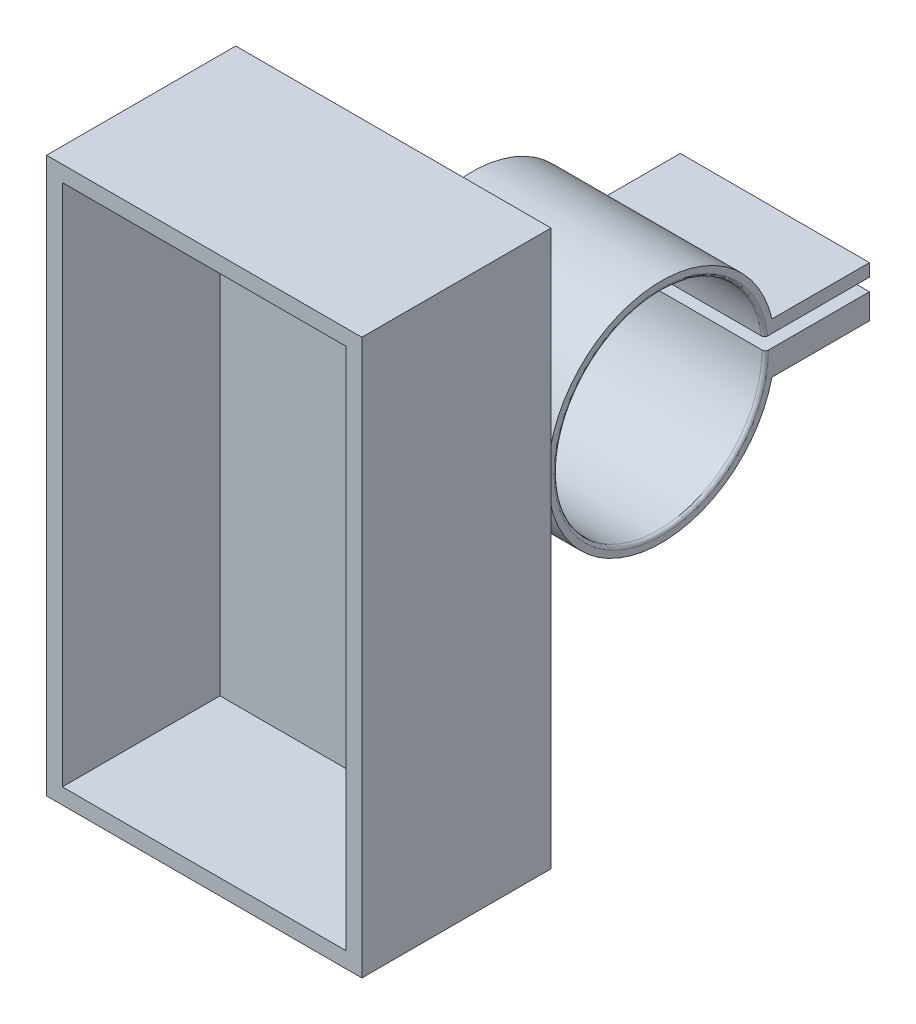
from build123d import *

# Parameters (mm, degrees)
ESBO_O1_W                     = 50
ESBO_O1_H                     = 88
RESSALTO_EXTRUS_O1_DEPTH      = 30
ESBO_O3_W                     = 45
ESBO_O3_H                     = 83
CORTE_EXTRUS_O1_DEPTH         = 25
ESBO_O7_R                     = 10.25
RESSALTO_EXTRUS_O3_DEPTH      = 15
FILETE1_R                     = 4
RESSALTO_EXTRUS_O4_DEPTH      = 15
RESSALTO_EXTRUS_O4_DEPTH_BACK = 15
ESBO_O9_R                     = 18
ESBO_O10_R                    = 16.5
CORTE_EXTRUS_O2_DEPTH         = 40
RESSALTO_EXTRUS_O5_DEPTH      = 15
RESSALTO_EXTRUS_O5_DEPTH_BACK = 15
ESBO_O12_W                    = 17
ESBO_O12_H                    = 2
CORTE_EXTRUS_O3_DEPTH         = 40
FILETE2_R                     = 0.5
FILETE3_R                     = 0.5


with BuildPart() as part:
    # Esboço1 → Ressalto-extrusão1 (new body)
    with BuildSketch(Plane.XY):
        Rectangle(ESBO_O1_W, ESBO_O1_H)
    extrude(amount=RESSALTO_EXTRUS_O1_DEPTH)

    # Esboço3 → Corte-extrusão1 (cut)
    with BuildSketch(Plane.XY.offset(30)):
        Rectangle(ESBO_O3_W, ESBO_O3_H)
    extrude(amount=-CORTE_EXTRUS_O1_DEPTH, mode=Mode.SUBTRACT)

    # Esboço7 → Ressalto-extrusão3 (add)
    with BuildSketch(Plane(origin=(0, 0, 0), x_dir=(-1, 0, 0), z_dir=(0, 0, -1))):
        Circle(ESBO_O7_R)
    extrude(amount=RESSALTO_EXTRUS_O3_DEPTH)

    # Filete1
    filete1_edges = [part.edges().sort_by_distance(p)[0] for p in [
        (10.25, 0, 0),
    ]]
    fillet(filete1_edges, radius=FILETE1_R)

    # Esboço9 → Ressalto-extrusão4 (add, two sides: drawn at the far end of the back side and taken through both)
    with BuildSketch(Plane(origin=(0, 0, 0), x_dir=(0, 0, -1), z_dir=(1, 0, 0)).offset(-RESSALTO_EXTRUS_O4_DEPTH_BACK)):
        with Locations((27.479364999, 0)):
            Circle(ESBO_O9_R)
    extrude(amount=RESSALTO_EXTRUS_O4_DEPTH + RESSALTO_EXTRUS_O4_DEPTH_BACK)

    # Esboço10 → Corte-extrusão2 (cut)
    with BuildSketch(Plane(origin=(15, 0, 0), x_dir=(0, 0, -1), z_dir=(1, 0, 0))):
        with Locations((27.479364999, 0)):
            Circle(ESBO_O10_R)
    extrude(amount=-CORTE_EXTRUS_O2_DEPTH, mode=Mode.SUBTRACT)

    # Esboço11 → Ressalto-extrusão5 (add, two sides: drawn at the far end of the back side and taken through both)
    with BuildSketch(Plane(origin=(0, 0, 0), x_dir=(0, 0, -1), z_dir=(1, 0, 0)).offset(-RESSALTO_EXTRUS_O5_DEPTH_BACK)):
        Polygon((60.492568737, 0), (60.492568737, 4), (45.029293774, 4), (45.029293774, -4), (60.492568737, -4), align=None)
    extrude(amount=RESSALTO_EXTRUS_O5_DEPTH + RESSALTO_EXTRUS_O5_DEPTH_BACK)

    # Esboço12 → Corte-extrusão3 (cut)
    with BuildSketch(Plane(origin=(15, 0, 0), x_dir=(0, 0, -1), z_dir=(1, 0, 0))):
        with Locations((51.992568737, 1)):
            Rectangle(ESBO_O12_W, ESBO_O12_H)
    extrude(amount=-CORTE_EXTRUS_O3_DEPTH, mode=Mode.SUBTRACT)

    # Filete2
    filete2_edges = [part.edges().sort_by_distance(p)[0] for p in [
        (15, -1.001848456, -11.009808245),
    ]]
    fillet(filete2_edges, radius=FILETE2_R)

    # Filete3
    filete3_edges = [part.edges().sort_by_distance(p)[0] for p in [
        (-15, -1.001848456, -11.009808245),
    ]]
    fillet(filete3_edges, radius=FILETE3_R)


solid = part.part
